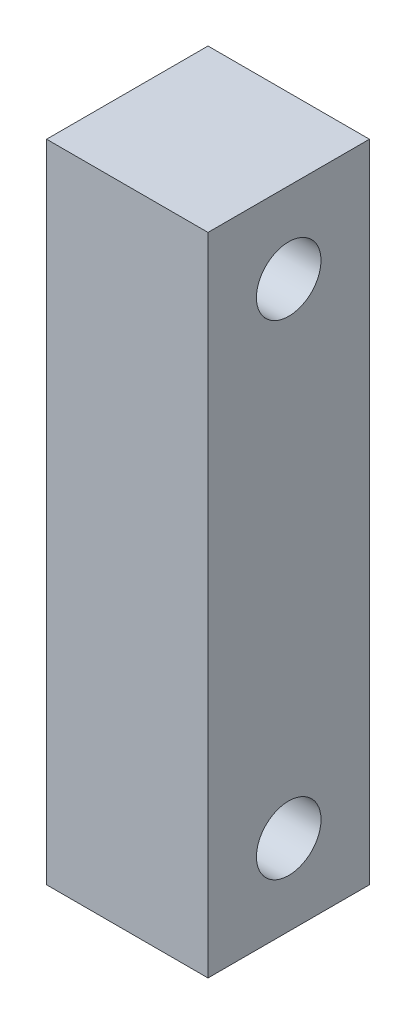
from build123d import *

# Parameters (mm, degrees)
SKETCH1_W           = 10
SKETCH1_H           = 40
BOSS_EXTRUDE1_DEPTH = 10
SKETCH3_R           = 2
CUT_EXTRUDE2_DEPTH  = 43.426406871


with BuildPart() as part:
    # Sketch1 → Boss-Extrude1 (new body)
    with BuildSketch(Plane.XY):
        with Locations((5, 20)):
            Rectangle(SKETCH1_W, SKETCH1_H)
    extrude(amount=BOSS_EXTRUDE1_DEPTH)

    # Sketch3 → Cut-Extrude2 (cut, through all)
    with BuildSketch(Plane.ZY):
        with Locations((5, 35)):
            Circle(SKETCH3_R)
        with Locations(Location((5, 5, 0), (0, 0, 180))):
            Circle(SKETCH3_R)
    extrude(amount=-CUT_EXTRUDE2_DEPTH, mode=Mode.SUBTRACT)


solid = part.part
